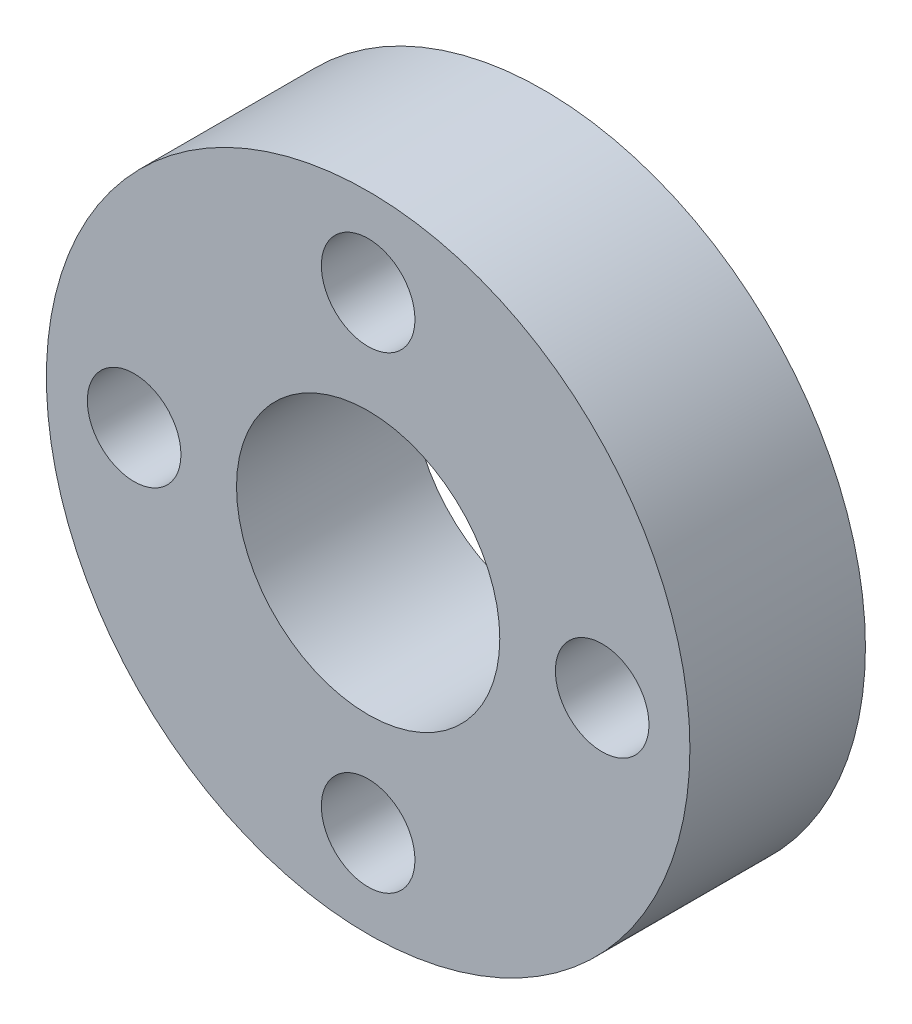
from build123d import *

# Parameters (mm, degrees)
SKETCH1_R           = 11
SKETCH1_R_2         = 4.5
SKETCH1_R_3         = 1.6
BOSS_EXTRUDE1_DEPTH = 6


with BuildPart() as part:
    # Sketch1 → Boss-Extrude1 (new body)
    with BuildSketch(Plane.XY):
        Circle(SKETCH1_R)
        Circle(SKETCH1_R_2, mode=Mode.SUBTRACT)
        with Locations((8, 0)):
            Circle(SKETCH1_R_3, mode=Mode.SUBTRACT)
        with Locations((0, 8)):
            Circle(SKETCH1_R_3, mode=Mode.SUBTRACT)
        with Locations((-8, 0)):
            Circle(SKETCH1_R_3, mode=Mode.SUBTRACT)
        with Locations((0, -8)):
            Circle(SKETCH1_R_3, mode=Mode.SUBTRACT)
    extrude(amount=BOSS_EXTRUDE1_DEPTH)


solid = part.part
